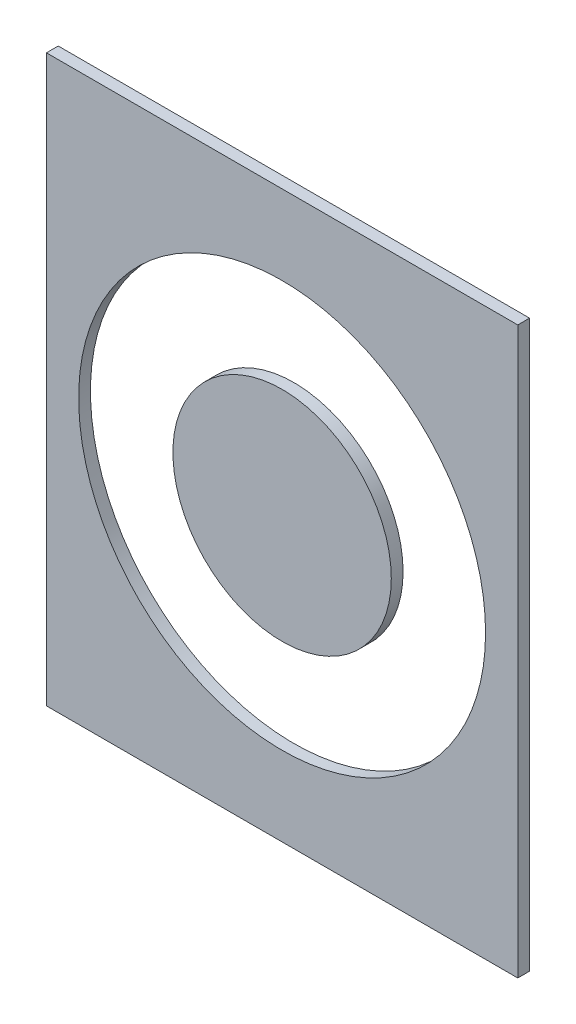
from build123d import *

# Parameters (mm, degrees)
ESQUISSE1_W             = 600
ESQUISSE1_H             = 720
BOSS_EXTRU_1_DEPTH      = 15
ESQUISSE2_R             = 259
ESQUISSE2_R_2           = 139
ENL_V_MAT_EXTRU_1_DEPTH = 15


with BuildPart() as part:
    # Esquisse1 → Boss.-Extru.1 (new body)
    with BuildSketch(Plane.XY):
        Rectangle(ESQUISSE1_W, ESQUISSE1_H)
    extrude(amount=BOSS_EXTRU_1_DEPTH)

    # Esquisse2 → Enlèv. mat.-Extru.1 (cut)
    with BuildSketch(Plane.XY.offset(15)):
        Circle(ESQUISSE2_R)
        Circle(ESQUISSE2_R_2, mode=Mode.SUBTRACT)
    extrude(amount=-ENL_V_MAT_EXTRU_1_DEPTH, mode=Mode.SUBTRACT)


with BuildPart() as enl_v_mat_extru_1_piece_1:
    # of the separate pieces the step leaves, piece 1, a body of its own (enl_v_mat_extru_1_pieces)
    add(part.part.solids().sort_by_distance((300, -360, 0))[0])


with BuildPart() as enl_v_mat_extru_1_piece_2:
    # of the separate pieces the step leaves, piece 2, a body of its own (enl_v_mat_extru_1_pieces)
    add(part.part.solids().sort_by_distance((139, 0, 0))[0])


solid = Compound([enl_v_mat_extru_1_piece_1.part, enl_v_mat_extru_1_piece_2.part])
